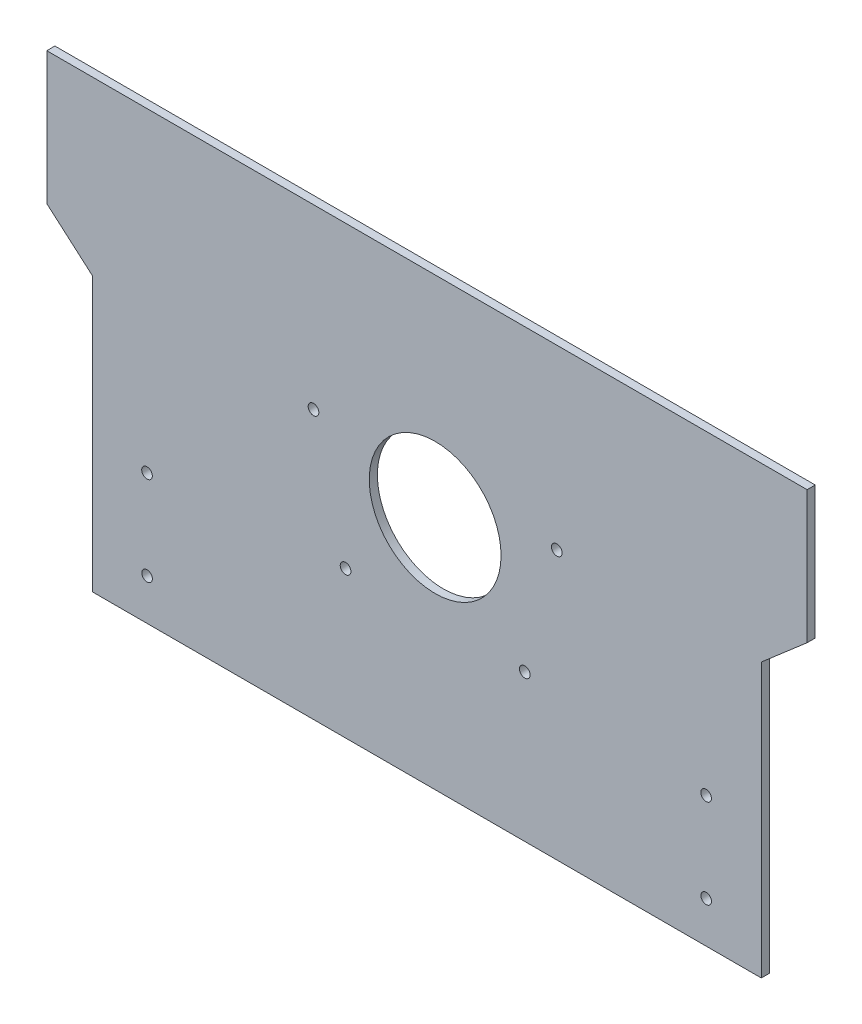
from build123d import *

# Parameters (mm, degrees)
SKETCH1_R           = 13
SKETCH1_R_2         = 1.05
SKETCH1_R_3         = 1.044026492
BOSS_EXTRUDE1_DEPTH = 1.6


with BuildPart() as part:
    # Sketch1 → Boss-Extrude1 (new body)
    with BuildSketch(Plane.XY):
        Polygon((72.39, -58.58), (72.4, -84.71), (81.44, -92.56), (81.43, -146.54), (213.35, -146.53), (213.35, -92.55), (222.39, -84.73), (222.39, -58.58), align=None)
        with Locations((149.01, -100.02)):
            Circle(SKETCH1_R, mode=Mode.SUBTRACT)
        with Locations((202.46, -120.78)):
            Circle(SKETCH1_R_2, mode=Mode.SUBTRACT)
        with Locations((202.48, -138.37)):
            Circle(SKETCH1_R_2, mode=Mode.SUBTRACT)
        with Locations((92.18, -138.41)):
            Circle(SKETCH1_R_3, mode=Mode.SUBTRACT)
        with Locations((92.17, -120.83)):
            Circle(SKETCH1_R_2, mode=Mode.SUBTRACT)
        with Locations((131.334, -117.57)):
            Circle(SKETCH1_R_2, mode=Mode.SUBTRACT)
        with Locations((166.686, -117.57)):
            Circle(SKETCH1_R_2, mode=Mode.SUBTRACT)
        with Locations((173.01, -93.57)):
            Circle(SKETCH1_R_2, mode=Mode.SUBTRACT)
        with Locations((125.01, -93.57)):
            Circle(SKETCH1_R_2, mode=Mode.SUBTRACT)
    extrude(amount=BOSS_EXTRUDE1_DEPTH)


solid = part.part
